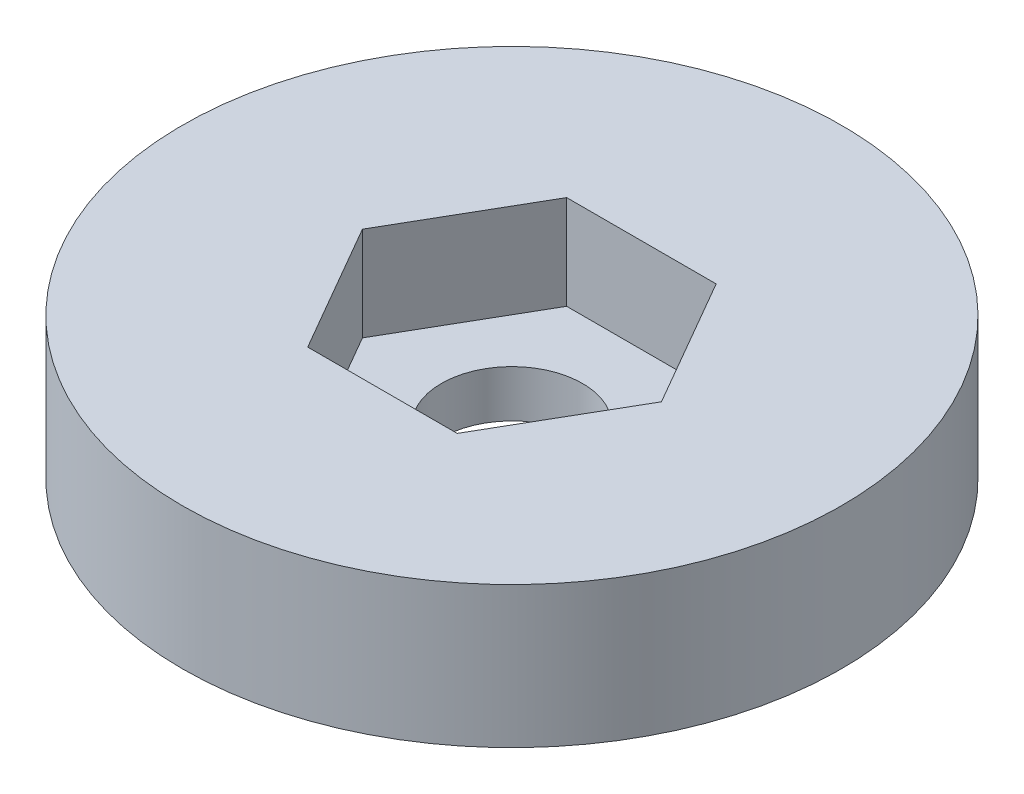
from build123d import *

# Parameters (mm, degrees)
SKETCH_1_R          = 7
SKETCH_1_R_2        = 1.5
EXTRUDE_1_DEPTH     = 3
CUT_EXTRUDE_1_DEPTH = 2


with BuildPart() as part:
    # Эскиз1 → Бобышка-Вытянуть1 (new body)
    with BuildSketch(Plane(origin=(0, 0, 0), x_dir=(1, 0, 0), z_dir=(0, 1, 0))):
        with Locations(Location((0, 0, 0), (0, 0, 270))):
            Circle(SKETCH_1_R)
        with Locations(Location((0, 0, 0), (0, 0, 270))):
            Circle(SKETCH_1_R_2, mode=Mode.SUBTRACT)
    extrude(amount=EXTRUDE_1_DEPTH)

    # Эскиз2 → Вырез-Вытянуть1 (cut)
    with BuildSketch(Plane(origin=(0, 3, 0), x_dir=(1, 0, 0), z_dir=(0, 1, 0))):
        Polygon((1.58771324, 2.75), (-1.58771324, 2.75), (-3.175426481, 0), (-1.58771324, -2.75), (1.58771324, -2.75), (3.175426481, 0), align=None)
    extrude(amount=-CUT_EXTRUDE_1_DEPTH, mode=Mode.SUBTRACT)


solid = part.part
